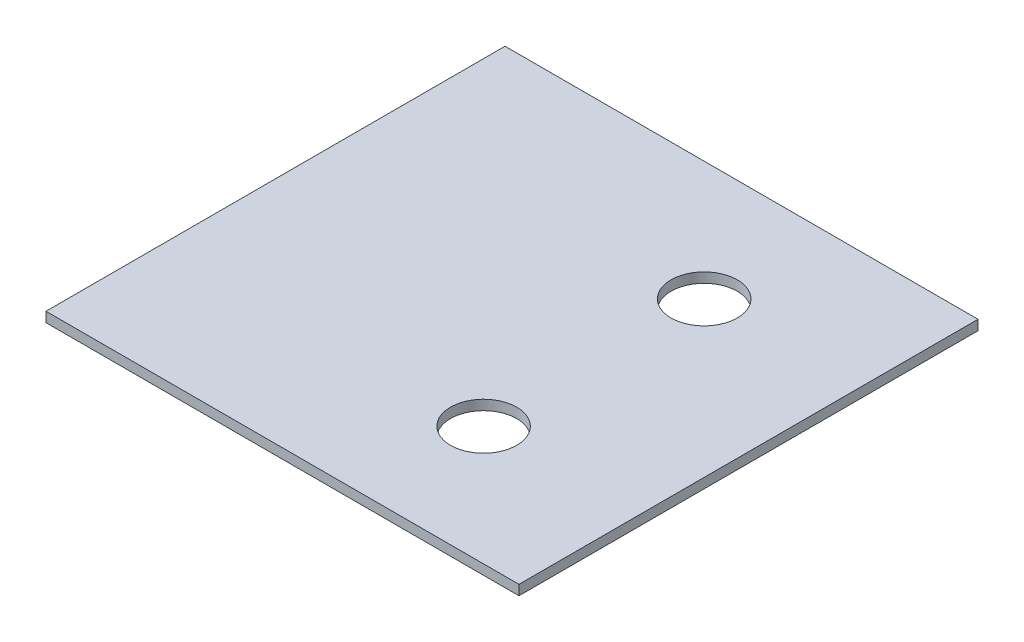
from build123d import *

# Parameters (mm, degrees)
SKETCH1_W           = 23.8
SKETCH1_H           = 23.1
BOSS_EXTRUDE1_DEPTH = 0.5
CUT_EXTRUDE1_REACH  = 18.591
SKETCH2_R           = 1.665


with BuildPart() as part:
    # Sketch1 → Boss-Extrude1 (new body)
    with BuildSketch(Plane(origin=(0, 0, 0), x_dir=(1, 0, 0), z_dir=(0, 1, 0))):
        Rectangle(SKETCH1_W, SKETCH1_H)
    extrude(amount=BOSS_EXTRUDE1_DEPTH)

    # Sketch2 → Cut-Extrude1 (cut, up to next)
    with BuildSketch(Plane(origin=(0, 0.5, 0), x_dir=(1, 0, 0), z_dir=(0, 1, 0)), mode=Mode.PRIVATE) as cut_extrude1_sk1:
        with Locations(Location((4.121380866, 5.549386368, 0), (0, 0, 270))):
            Circle(SKETCH2_R)
    cut_extrude1_tool1 = extrude(cut_extrude1_sk1.sketch, amount=-CUT_EXTRUDE1_REACH, mode=Mode.PRIVATE) & part.part
    # Sketch2 → Cut-Extrude1 (cut, up to next)
    with BuildSketch(Plane(origin=(0, 0.5, 0), x_dir=(1, 0, 0), z_dir=(0, 1, 0)), mode=Mode.PRIVATE) as cut_extrude1_sk2:
        with Locations(Location((4.121380866, -5.55, 0), (0, 0, 270))):
            Circle(SKETCH2_R)
    cut_extrude1_tool2 = extrude(cut_extrude1_sk2.sketch, amount=-CUT_EXTRUDE1_REACH, mode=Mode.PRIVATE) & part.part
    add(cut_extrude1_tool1.solids().sort_by_distance((4.121381, 0.5, -5.549386))[0], mode=Mode.SUBTRACT)
    add(cut_extrude1_tool2.solids().sort_by_distance((4.121381, 0.5, 5.55))[0], mode=Mode.SUBTRACT)


solid = part.part
